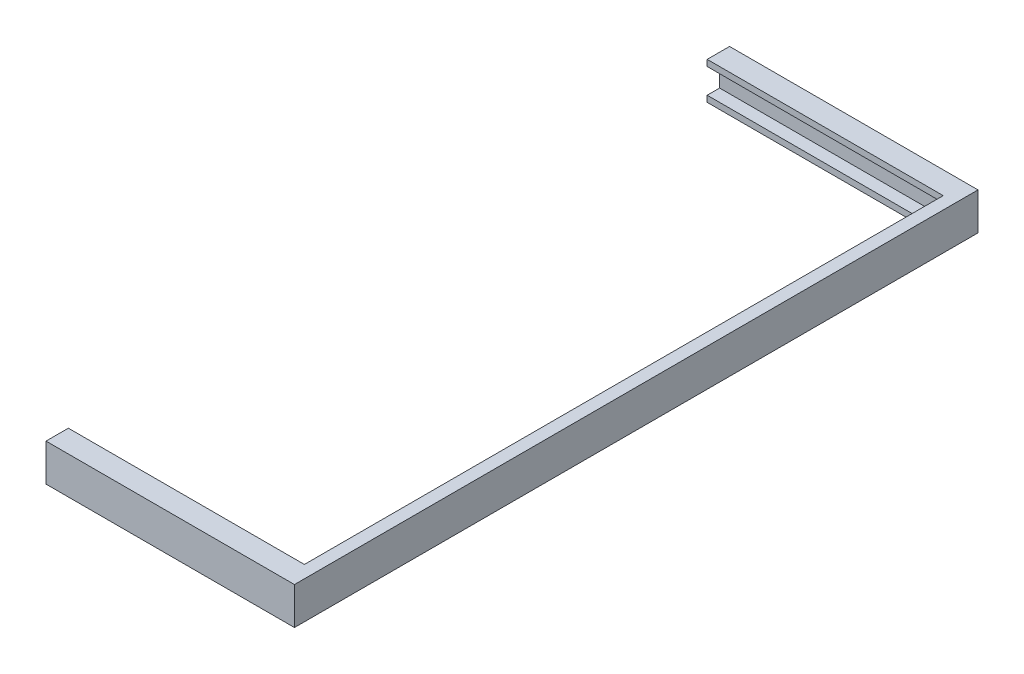
from build123d import *

# Parameters (mm, degrees)
ESQUISSE1_W        = 100
ESQUISSE1_H        = 15
BOSS_EXTRU_1_DEPTH = 4
ESQUISSE2_W        = 100
ESQUISSE2_H        = 2.5
BOSS_EXTRU_2_DEPTH = 5
ESQUISSE3_W        = 5
ESQUISSE3_H        = 15
BOSS_EXTRU_3_DEPTH = 267.12


with BuildPart() as part:
    # Esquisse1 → Boss.-Extru.1 (new body)
    with BuildSketch(Plane.XY):
        with Locations((50, 7.5)):
            Rectangle(ESQUISSE1_W, ESQUISSE1_H)
    boss_extru_1 = extrude(amount=BOSS_EXTRU_1_DEPTH)

    # Esquisse2 → Boss.-Extru.2 (add)
    with BuildSketch(Plane.XY.offset(4)):
        with Locations((50, 13.75)):
            Rectangle(ESQUISSE2_W, ESQUISSE2_H)
        with Locations((50, 1.25)):
            Rectangle(ESQUISSE2_W, ESQUISSE2_H)
    boss_extru_2 = extrude(amount=BOSS_EXTRU_2_DEPTH)

    # Esquisse3 → Boss.-Extru.3 (add)
    with BuildSketch(Plane.XY.offset(4)):
        with Locations((97.5, 7.5)):
            Rectangle(ESQUISSE3_W, ESQUISSE3_H)
    extrude(amount=BOSS_EXTRU_3_DEPTH)

    # Symétrie2: Boss.-Extru.1, Boss.-Extru.2 across plane
    add(boss_extru_1.mirror(Plane.XY.offset(137.56)))
    add(boss_extru_2.mirror(Plane.XY.offset(137.56)))


solid = part.part
